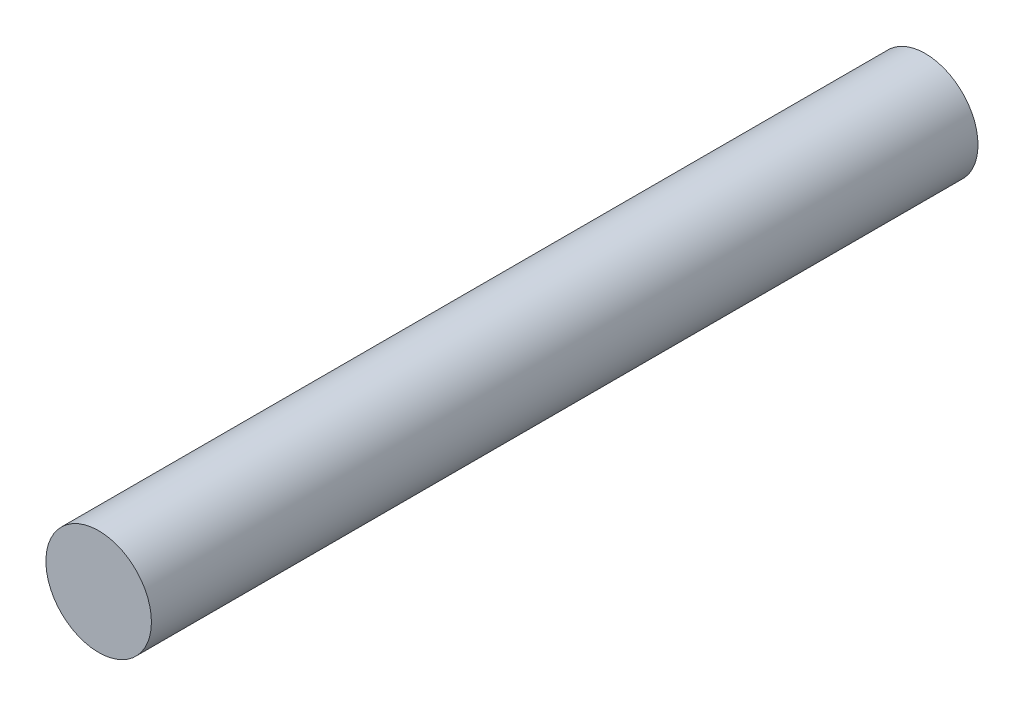
from build123d import *

# Parameters (mm, degrees)
SKETCH1_R           = 0.75
BOSS_EXTRUDE1_DEPTH = 19.5
SKETCH2_R           = 1.5
BOSS_EXTRUDE2_DEPTH = 19.5
SKETCH4_R           = 1.5
BOSS_EXTRUDE3_DEPTH = 4


with BuildPart() as part:
    # Sketch1 → Boss-Extrude1 (new body)
    with BuildSketch(Plane.XY):
        Circle(SKETCH1_R)
    extrude(amount=BOSS_EXTRUDE1_DEPTH)

    # Sketch2 → Boss-Extrude2 (add)
    with BuildSketch(Plane.XY.offset(19.5)):
        Circle(SKETCH2_R)
    extrude(amount=-BOSS_EXTRUDE2_DEPTH)

    # Sketch4 → Boss-Extrude3 (add)
    with BuildSketch(Plane(origin=(0, 0, 0), x_dir=(-1, 0, 0), z_dir=(0, 0, -1))):
        with Locations(Location((0, 0, 0), (0, 0, 180))):
            Circle(SKETCH4_R)
    extrude(amount=BOSS_EXTRUDE3_DEPTH)


solid = part.part
